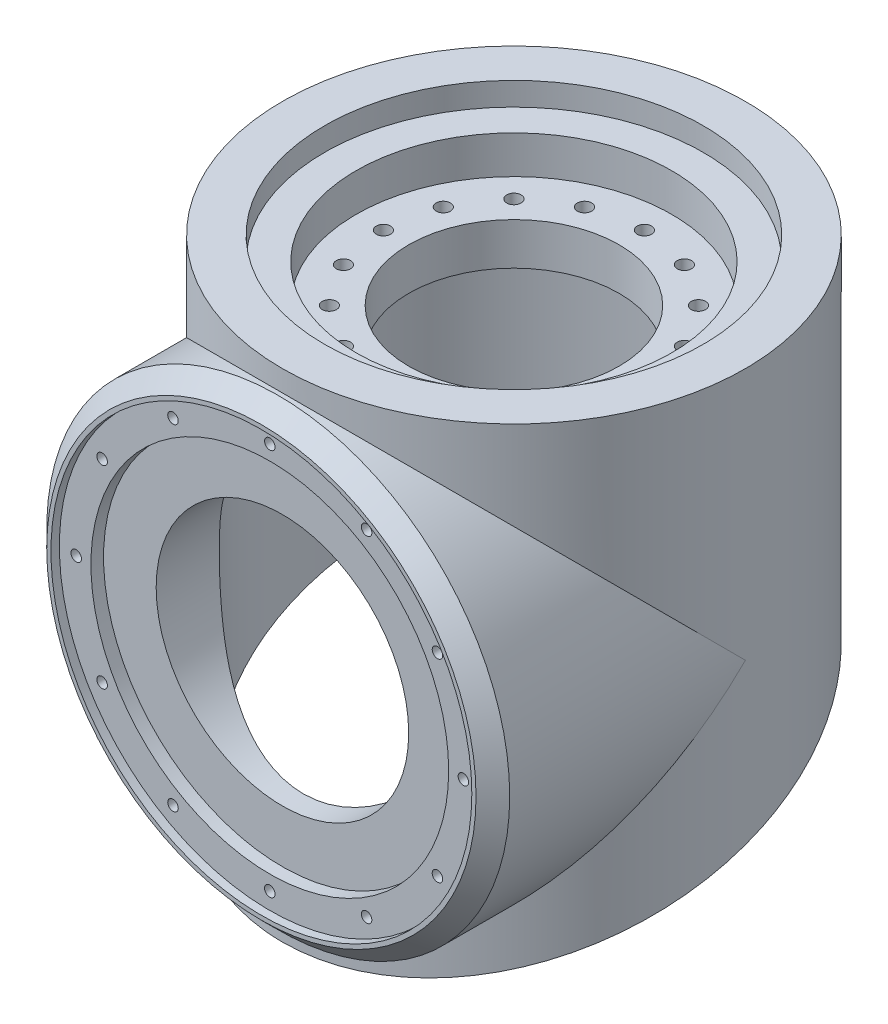
from build123d import *

# Parameters (mm, degrees)
SKETCH_1_R                = 55
EXTRUDE_1_DEPTH           = 60
EXTRUDE_2_DEPTH           = 60
EXTRUDE_2_DEPTH_BACK      = 58
SKETCH_2_R                = 55
SKETCH_3_R                = 25
CUT_EXTRUDE_1_DEPTH       = 144.349223925
SKETCH_4_R                = 45
CUT_EXTRUDE_2_DEPTH       = 5.5
SKETCH_5_R                = 37.5
CUT_EXTRUDE_3_DEPTH       = 9
SKETCH_8_R                = 50
CUT_EXTRUDE_4_DEPTH       = 93.5
HOLE_WIZARD_1_D           = 3.4
HOLE_WIZARD_1_CBORE_D     = 6
HOLE_WIZARD_1_CBORE_DEPTH = 3.4
PATTERN_CIRCULAR_2_COUNT  = 16
CUT_EXTRUDE_5_DEPTH       = 102.118742081
CUT_EXTRUDE_5_DEPTH_BACK  = 102.118742081
SKETCH_12_R               = 1
CUT_EXTRUDE_6_DEPTH       = 25
SKETCH_13_R               = 1
CUT_EXTRUDE_7_DEPTH       = 48
SKETCH_14_R               = 1
CUT_EXTRUDE_8_DEPTH       = 10
SKETCH_20_R               = 50
CUT_EXTRUDE_15_DEPTH      = 2
SKETCH_18_R               = 42.5
CUT_EXTRUDE_12_DEPTH      = 5
PATTERN_CIRCULAR_3_COUNT  = 12
SKETCH_21_R               = 30
CUT_EXTRUDE_16_DEPTH      = 20
CHAMFER_2_SIZE            = 4


with BuildPart() as part:
    # 草图1 → 凸台-拉伸1 (new body)
    with BuildSketch(Plane.XY):
        Circle(SKETCH_1_R)
    extrude(amount=EXTRUDE_1_DEPTH)

    # 草图2 → 凸台-拉伸2 (add, two sides: drawn at the far end of the back side and taken through both)
    with BuildSketch(Plane(origin=(0, 0, 0), x_dir=(1, 0, 0), z_dir=(0, 1, 0)).offset(-EXTRUDE_2_DEPTH_BACK)):
        with Locations(Location((0, 0, 0), (0, 0, 270))):
            Circle(SKETCH_2_R)
    extrude(amount=EXTRUDE_2_DEPTH + EXTRUDE_2_DEPTH_BACK)

    # 草图3 → 切除-拉伸1 (cut, through all)
    with BuildSketch(Plane.XZ.offset(58)):
        with Locations(Location((0, 0, 0), (0, 0, 270))):
            Circle(SKETCH_3_R)
    extrude(amount=-CUT_EXTRUDE_1_DEPTH, mode=Mode.SUBTRACT)

    # 草图4 → 切除-拉伸2 (cut)
    with BuildSketch(Plane(origin=(0, 60, 0), x_dir=(1, 0, 0), z_dir=(0, 1, 0))):
        with Locations(Location((0, 0, 0), (0, 0, 270))):
            Circle(SKETCH_4_R)
    extrude(amount=-CUT_EXTRUDE_2_DEPTH, mode=Mode.SUBTRACT)

    # 草图5 → 切除-拉伸3 (cut)
    with BuildSketch(Plane(origin=(0, 54.5, 0), x_dir=(1, 0, 0), z_dir=(0, 1, 0))):
        with Locations(Location((0, 0, 0), (0, 0, 270))):
            Circle(SKETCH_5_R)
    extrude(amount=-CUT_EXTRUDE_3_DEPTH, mode=Mode.SUBTRACT)

    # 草图8 → 切除-拉伸4 (cut)
    with BuildSketch(Plane.XZ.offset(58)):
        with Locations(Location((0, 0, 0), (0, 0, 270))):
            Circle(SKETCH_8_R)
    extrude(amount=-CUT_EXTRUDE_4_DEPTH, mode=Mode.SUBTRACT)

    # 打孔尺寸(%根据)内六角圆柱头螺钉的类型1 (through all)
    with Locations(Plane(origin=(0, 35.5, 0), x_dir=(-1, 0, 0), z_dir=(0, -1, 0))):
        with Locations((0, -31)):
            hole_wizard_1 = CounterBoreHole(HOLE_WIZARD_1_D / 2, HOLE_WIZARD_1_CBORE_D / 2, HOLE_WIZARD_1_CBORE_DEPTH)

    # 阵列(圆周)2: 打孔尺寸(%根据)内六角圆柱头螺钉的类型1 ×16 about axis
    pattern_circular_2_axis = Axis((0, 0, 0), (0, 1, 0))
    for i in range(1, PATTERN_CIRCULAR_2_COUNT):
        add(hole_wizard_1.rotate(pattern_circular_2_axis, i * 360 / PATTERN_CIRCULAR_2_COUNT), mode=Mode.SUBTRACT)

    # 草图11 → 切除-拉伸5 (cut, two sides: drawn at the far end of the back side and taken through both)
    with BuildSketch(Plane(origin=(0, 0, 0), x_dir=(0, 0, -1), z_dir=(1, 0, 0)).offset(-CUT_EXTRUDE_5_DEPTH_BACK)):
        Polygon((-55, -58), (55, -58), (55, -17.963274231), align=None)
    extrude(amount=CUT_EXTRUDE_5_DEPTH + CUT_EXTRUDE_5_DEPTH_BACK, mode=Mode.SUBTRACT)

    # 草图12 → 切除-拉伸6 (cut)
    with BuildSketch(Plane(origin=(0, -58, 0), x_dir=(1, 0, 0), z_dir=(0, 1, 0))):
        with Locations(Location((52.5, 0, 0), (0, 0, 270))):
            Circle(SKETCH_12_R)
        with Locations(Location((-52.5, 0, 0), (0, 0, 270))):
            Circle(SKETCH_12_R)
    extrude(amount=CUT_EXTRUDE_6_DEPTH, mode=Mode.SUBTRACT)

    # 草图13 → 切除-拉伸7 (cut)
    with BuildSketch(Plane(origin=(0, -58, 0), x_dir=(1, 0, 0), z_dir=(0, 1, 0))):
        with Locations(Location((0, 52.5, 0), (0, 0, 270))):
            Circle(SKETCH_13_R)
    extrude(amount=CUT_EXTRUDE_7_DEPTH, mode=Mode.SUBTRACT)

    # 草图14 → 切除-拉伸8 (cut)
    with BuildSketch(Plane(origin=(0, -58, 0), x_dir=(1, 0, 0), z_dir=(0, 1, 0))):
        with Locations(Location((0, -52.5, 0), (0, 0, 270))):
            Circle(SKETCH_14_R)
    extrude(amount=CUT_EXTRUDE_8_DEPTH, mode=Mode.SUBTRACT)

    # 草图20 → 切除-拉伸15 (cut)
    with BuildSketch(Plane.XY.offset(60)):
        Circle(SKETCH_20_R)
    extrude(amount=-CUT_EXTRUDE_15_DEPTH, mode=Mode.SUBTRACT)

    # 草图18 → 切除-拉伸12 (cut)
    with BuildSketch(Plane.XY.offset(60)):
        Circle(SKETCH_18_R)
    extrude(amount=-CUT_EXTRUDE_12_DEPTH, mode=Mode.SUBTRACT)

    # 草图16 → M3 螺纹孔2 (revolve, cut)
    with BuildSketch(Plane(origin=(0, 46, 60), x_dir=(0, -1, 0), z_dir=(1, 0, 0))):
        Polygon((0, 0), (0, 8.251075774), (1.25, 7.5), (1.25, 0), align=None)
    hole_wizard_m3_2 = revolve(axis=Axis((0, 46, 66.35), (0, 0, -1)), mode=Mode.SUBTRACT)

    # 阵列(圆周)3: M3 螺纹孔2 ×12 about axis
    pattern_circular_3_axis = Axis((0, 0, 0), (0, 0, 1))
    for i in range(1, PATTERN_CIRCULAR_3_COUNT):
        add(hole_wizard_m3_2.rotate(pattern_circular_3_axis, i * 360 / PATTERN_CIRCULAR_3_COUNT), mode=Mode.SUBTRACT)

    # 草图21 → 切除-拉伸16 (cut)
    with BuildSketch(Plane.XY.offset(55)):
        Circle(SKETCH_21_R)
    extrude(amount=-CUT_EXTRUDE_16_DEPTH, mode=Mode.SUBTRACT)

    # 倒角2
    chamfer_2_edges = [part.edges().sort_by_distance(p)[0] for p in [
        (-55, 0, 60),
    ]]
    chamfer(chamfer_2_edges, length=CHAMFER_2_SIZE)


solid = part.part
